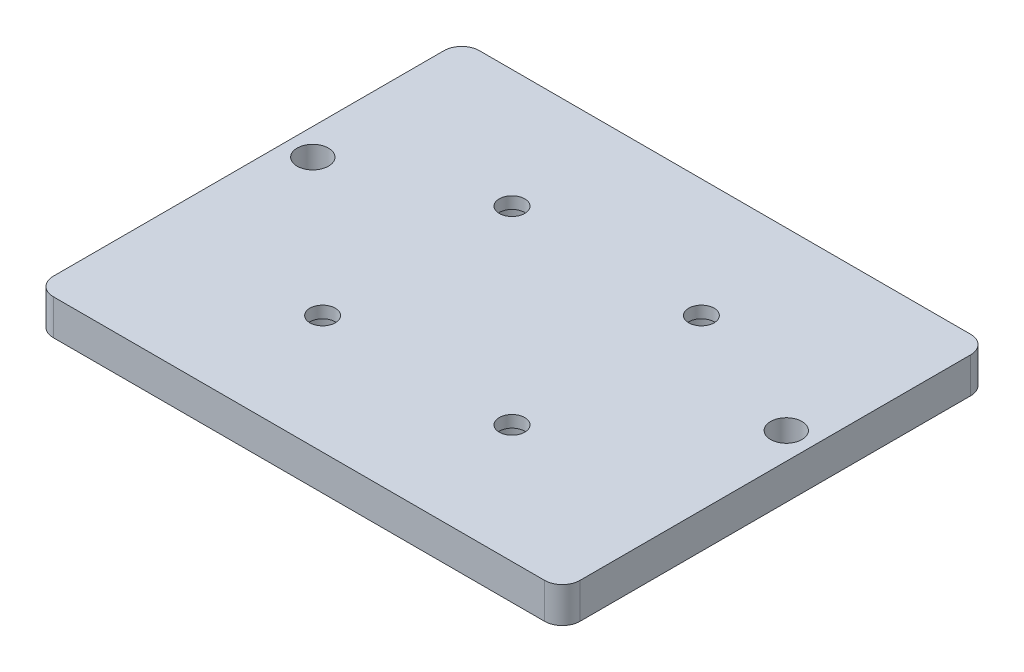
from build123d import *

# Parameters (mm, degrees)
SKETCH2_W                      = 89
SKETCH2_H                      = 72
BOSS_EXTRUDE1_DEPTH            = 6
CBORE_FOR_M4_SHCS1_D           = 4.3
CBORE_FOR_M4_SHCS1_CBORE_D     = 8
CBORE_FOR_M4_SHCS1_CBORE_DEPTH = 4
M5_CLEARANCE_HOLE1_D           = 5.3
FILLET1_R                      = 3


with BuildPart() as part:
    # Sketch2 → Boss-Extrude1 (new body)
    with BuildSketch(Plane(origin=(0, 0, 0), x_dir=(1, 0, 0), z_dir=(0, 1, 0))):
        Rectangle(SKETCH2_W, SKETCH2_H)
    extrude(amount=BOSS_EXTRUDE1_DEPTH)

    # CBORE for M4 SHCS1 (through all)
    with Locations(Plane(origin=(0, 0, 0), x_dir=(-1, 0, 0), z_dir=(0, -1, 0))):
        with Locations((-16, -16), (-16, 16), (16, 16), (16, -16)):
            CounterBoreHole(CBORE_FOR_M4_SHCS1_D / 2, CBORE_FOR_M4_SHCS1_CBORE_D / 2, CBORE_FOR_M4_SHCS1_CBORE_DEPTH)

    # M5 Clearance Hole1 (through all)
    with Locations(Plane(origin=(0, 6, 0), x_dir=(1, 0, 0), z_dir=(0, 1, 0))):
        with Locations((-40, 6.34428877), (40, 6.34428877)):
            Hole(M5_CLEARANCE_HOLE1_D / 2)

    # Fillet1
    fillet1_edges = [part.edges().sort_by_distance(p)[0] for p in [
        (-44.5, 3, -36),
        (44.5, 3, -36),
        (44.5, 3, 36),
        (-44.5, 3, 36),
    ]]
    fillet(fillet1_edges, radius=FILLET1_R)


solid = part.part
